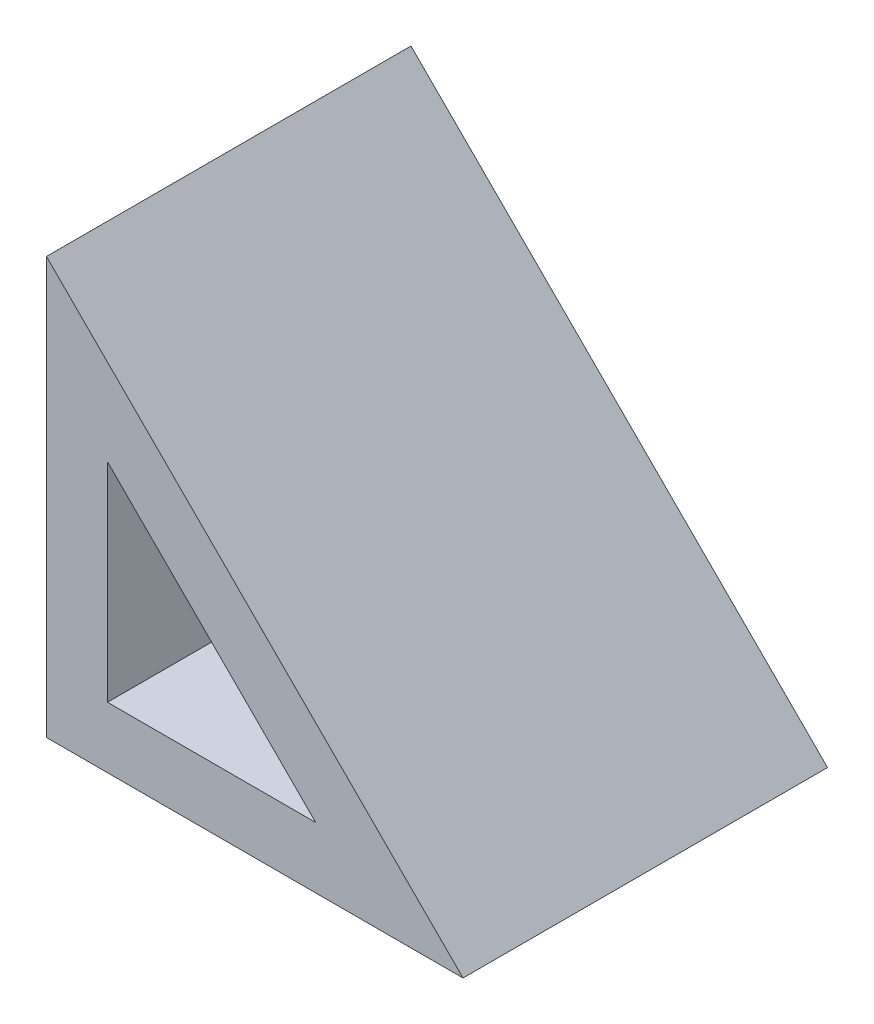
from build123d import *

# Parameters (mm, degrees)
BOSS_EXTRUDE1_DEPTH = 22.225
CUT_EXTRUDE1_DEPTH  = 43.240627659


with BuildPart() as part:
    # Sketch1 → Boss-Extrude1 (new body)
    with BuildSketch(Plane.XY):
        Polygon((0, 25.4), (25.4, 0), (0, 0), align=None)
    extrude(amount=BOSS_EXTRUDE1_DEPTH)

    # Sketch2 → Cut-Extrude1 (cut, through all)
    with BuildSketch(Plane.XY.offset(22.225)):
        Polygon((3.719743879, 16.419743879), (16.419743879, 3.719743879), (3.719743879, 3.719743879), align=None)
    extrude(amount=-CUT_EXTRUDE1_DEPTH, mode=Mode.SUBTRACT)


solid = part.part
